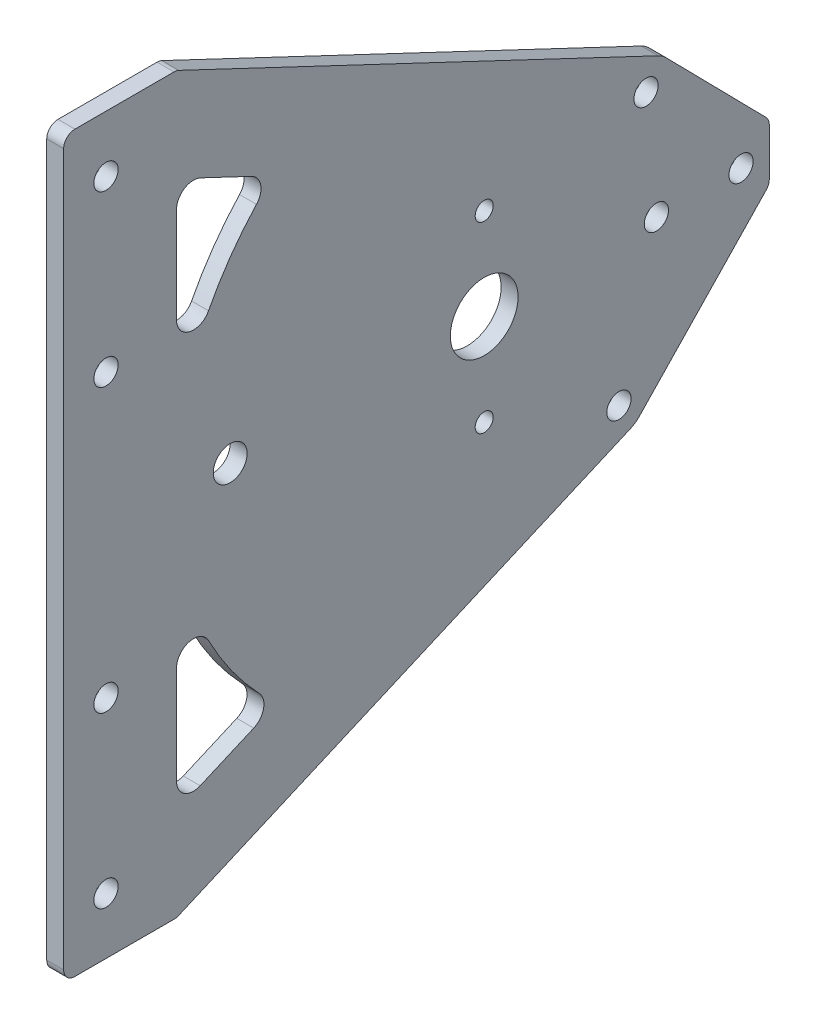
from build123d import *

# Parameters (mm, degrees)
SKETCH_1_R          = 2.15
SKETCH_1_R_2        = 6
SKETCH_1_R_3        = 3
SKETCH_1_R_4        = 1.6
EXTRUDE_1_DEPTH     = 3
CUT_EXTRUDE_1_DEPTH = 3
FILLET_1_R          = 2
FILLET_2_R          = 3


with BuildPart() as part:
    # ｽｹｯﾁ1 → ﾎﾞｽ - 押し出し1 (new body)
    with BuildSketch(Plane(origin=(0, 0, 0), x_dir=(0, 0, -1), z_dir=(1, 0, 0))):
        with BuildLine():
            Line((0, 0), (20, 0))
            Line((20, 0), (100.357645767, 34.814697588))
            ThreePointArc((100.357645767, 34.814697588), (101.226596702, 35.299021126), (101.982464697, 35.94578893))
            Line((101.982464697, 35.94578893), (125, 60))
            Line((125, 60), (125, 70))
            Line((125, 70), (106.736076333, 88.580227744))
            ThreePointArc((106.736076333, 88.580227744), (106.067997995, 89.149910996), (105.310570653, 89.593950967))
            Line((105.310570653, 89.593950967), (20, 130))
            Line((20, 130), (0, 130))
            Line((0, 130), (0, 0))
        make_face()
        with Locations((7.5, 120)):
            Circle(SKETCH_1_R, mode=Mode.SUBTRACT)
        with Locations((7.5, 90)):
            Circle(SKETCH_1_R, mode=Mode.SUBTRACT)
        with Locations(Location((7.5, 40, 0), (0, 0, 180))):
            Circle(SKETCH_1_R, mode=Mode.SUBTRACT)
        with Locations(Location((7.5, 10, 0), (0, 0, 180))):
            Circle(SKETCH_1_R, mode=Mode.SUBTRACT)
        with Locations((74.5, 65)):
            Circle(SKETCH_1_R_2, mode=Mode.SUBTRACT)
        with Locations((29.5, 65)):
            Circle(SKETCH_1_R_3, mode=Mode.SUBTRACT)
        with Locations((103.17032155, 85.075175272)):
            Circle(SKETCH_1_R, mode=Mode.SUBTRACT)
        with Locations((98.369942602, 39.402620443)):
            Circle(SKETCH_1_R, mode=Mode.SUBTRACT)
        with Locations((74.5, 81.215)):
            Circle(SKETCH_1_R_4, mode=Mode.SUBTRACT)
        with Locations(Location((74.5, 48.785, 0), (0, 0, 180))):
            Circle(SKETCH_1_R_4, mode=Mode.SUBTRACT)
        with Locations((105, 65)):
            Circle(SKETCH_1_R, mode=Mode.SUBTRACT)
        with Locations((120, 65)):
            Circle(SKETCH_1_R, mode=Mode.SUBTRACT)
    extrude(amount=EXTRUDE_1_DEPTH)

    # ｽｹｯﾁ2 → ｶｯﾄ - 押し出し1 (cut)
    with BuildSketch(Plane(origin=(3, 0, 0), x_dir=(0, 0, -1), z_dir=(1, 0, 0))):
        with BuildLine():
            Line((20, 113.402584003), (20, 72.399324293))
            ThreePointArc((20, 72.399324293), (25.68439104, 90.338435663), (37.083419962, 105.311283015))
            Line((37.083419962, 105.311283015), (20, 113.402584003))
        make_face()
        with BuildLine():
            Line((20, 16.347267022), (37.782097447, 24.051304879))
            ThreePointArc((37.782097447, 24.051304879), (25.904048448, 39.242797265), (20, 57.600675707))
            Line((20, 57.600675707), (20, 16.347267022))
        make_face()
    extrude(amount=-CUT_EXTRUDE_1_DEPTH, mode=Mode.SUBTRACT)

    # ﾌｨﾚｯﾄ1
    fillet_1_edges = [part.edges().sort_by_distance(p)[0] for p in [
        (1.5, 130, 0),
        (1.5, 130, -20),
        (1.5, 70, -125),
        (1.5, 60, -125),
        (1.5, 0, -20),
        (1.5, 0, 0),
    ]]
    fillet(fillet_1_edges, radius=FILLET_1_R)

    # ﾌｨﾚｯﾄ2
    fillet_2_edges = [part.edges().sort_by_distance(p)[0] for p in [
        (1.5, 105.311283015, -37.083419962),
        (1.5, 72.399324293, -20),
        (1.5, 113.402584003, -20),
        (1.5, 57.600675707, -20),
        (1.5, 24.051304879, -37.782097447),
        (1.5, 16.347267022, -20),
    ]]
    fillet(fillet_2_edges, radius=FILLET_2_R)


solid = part.part
